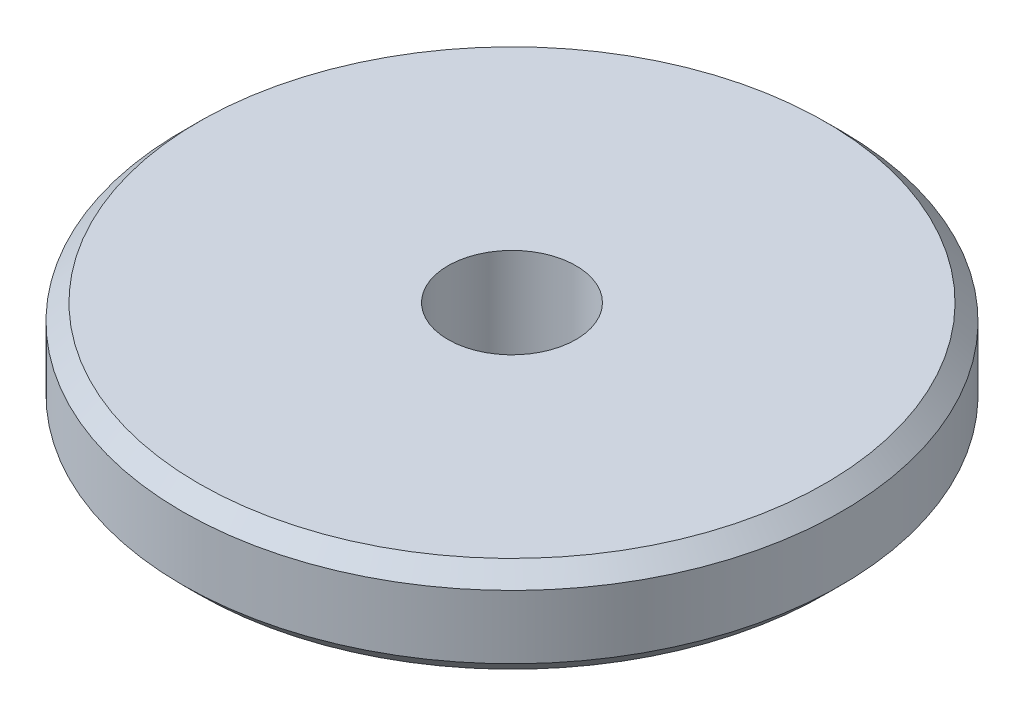
from build123d import *

# Parameters (mm, degrees)
SKETCH1_R       = 5.15
SKETCH1_R_2     = 1
BED_WHEEL_DEPTH = 1.5
CHAMFER1_SIZE   = 0.254


with BuildPart() as part:
    # Sketch1 → Bed Wheel (new body)
    with BuildSketch(Plane(origin=(0, 0, 0), x_dir=(1, 0, 0), z_dir=(0, 1, 0))):
        with Locations(Location((0, 0, 0), (0, 0, 270))):
            Circle(SKETCH1_R)
        with Locations(Location((0, 0, 0), (0, 0, 270))):
            Circle(SKETCH1_R_2, mode=Mode.SUBTRACT)
    extrude(amount=BED_WHEEL_DEPTH)

    # Chamfer1
    chamfer1_edges = [part.edges().sort_by_distance(p)[0] for p in [
        (0, 0, -5.15),
        (0, 1.5, -5.15),
    ]]
    chamfer(chamfer1_edges, length=CHAMFER1_SIZE)


solid = part.part
